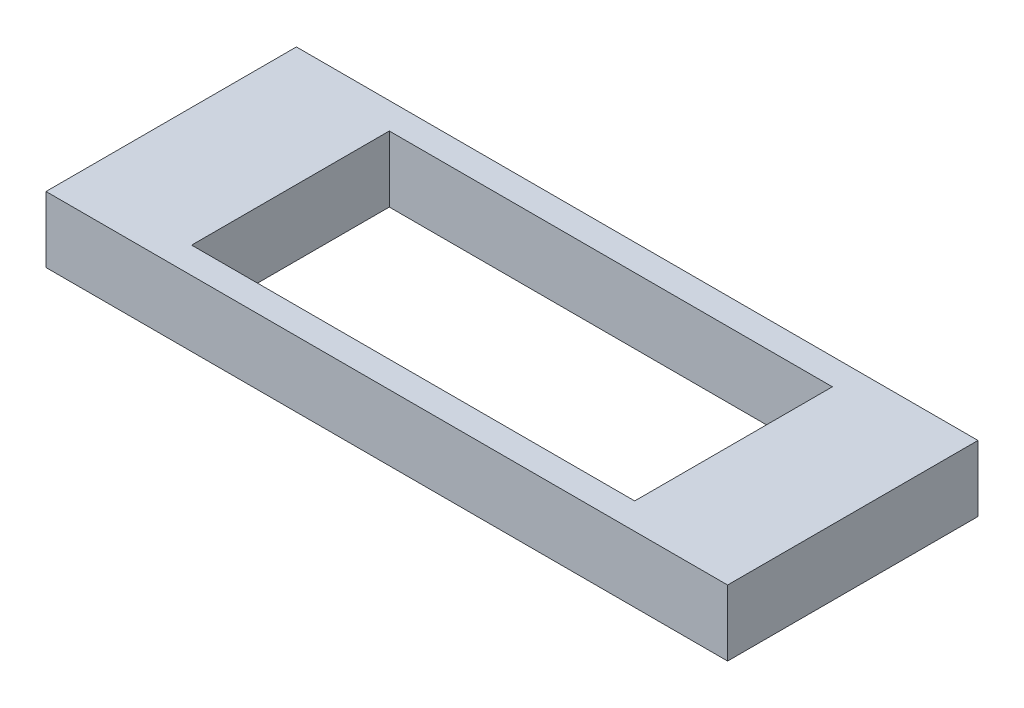
from build123d import *

# Parameters (mm, degrees)
SKETCH5_W           = 103.443318868
SKETCH5_H           = 10
EXTRUDE_THIN1_DEPTH = 66
SKETCH7_W           = 67.24350567
SKETCH7_H           = 56
CUT_EXTRUDE2_DEPTH  = 10
SKETCH8_W           = 67.24350567
SKETCH8_H           = 10
BOSS_EXTRUDE1_DEPTH = 26
SKETCH9_W           = 103.443318868
SKETCH9_H           = 27
SKETCH9_H_2         = 1
CUT_EXTRUDE3_DEPTH  = 10


with BuildPart() as part:
    # Sketch5 → Extrude-Thin1 (new body)
    with BuildSketch(Plane.XY):
        with Locations((0, 119.867131674)):
            Rectangle(SKETCH5_W, SKETCH5_H)
    extrude(amount=EXTRUDE_THIN1_DEPTH)

    # Sketch7 → Cut-Extrude2 (cut)
    with BuildSketch(Plane(origin=(0, 124.867131674, 0), x_dir=(1, 0, 0), z_dir=(0, 1, 0))):
        with Locations((0, -33)):
            Rectangle(SKETCH7_W, SKETCH7_H)
    extrude(amount=-CUT_EXTRUDE2_DEPTH, mode=Mode.SUBTRACT)

    # Sketch8 → Boss-Extrude1 (add)
    with BuildSketch(Plane(origin=(0, 0, 61), x_dir=(-1, 0, 0), z_dir=(0, 0, -1))):
        with Locations((0, 119.867131674)):
            Rectangle(SKETCH8_W, SKETCH8_H)
    extrude(amount=BOSS_EXTRUDE1_DEPTH)

    # Sketch9 → Cut-Extrude3 (cut)
    with BuildSketch(Plane(origin=(0, 124.867131674, 0), x_dir=(1, 0, 0), z_dir=(0, 1, 0))):
        with Locations((0, -52.5)):
            Rectangle(SKETCH9_W, SKETCH9_H)
        with Locations((0, -0.5)):
            Rectangle(SKETCH9_W, SKETCH9_H_2)
    extrude(amount=-CUT_EXTRUDE3_DEPTH, mode=Mode.SUBTRACT)


solid = part.part
